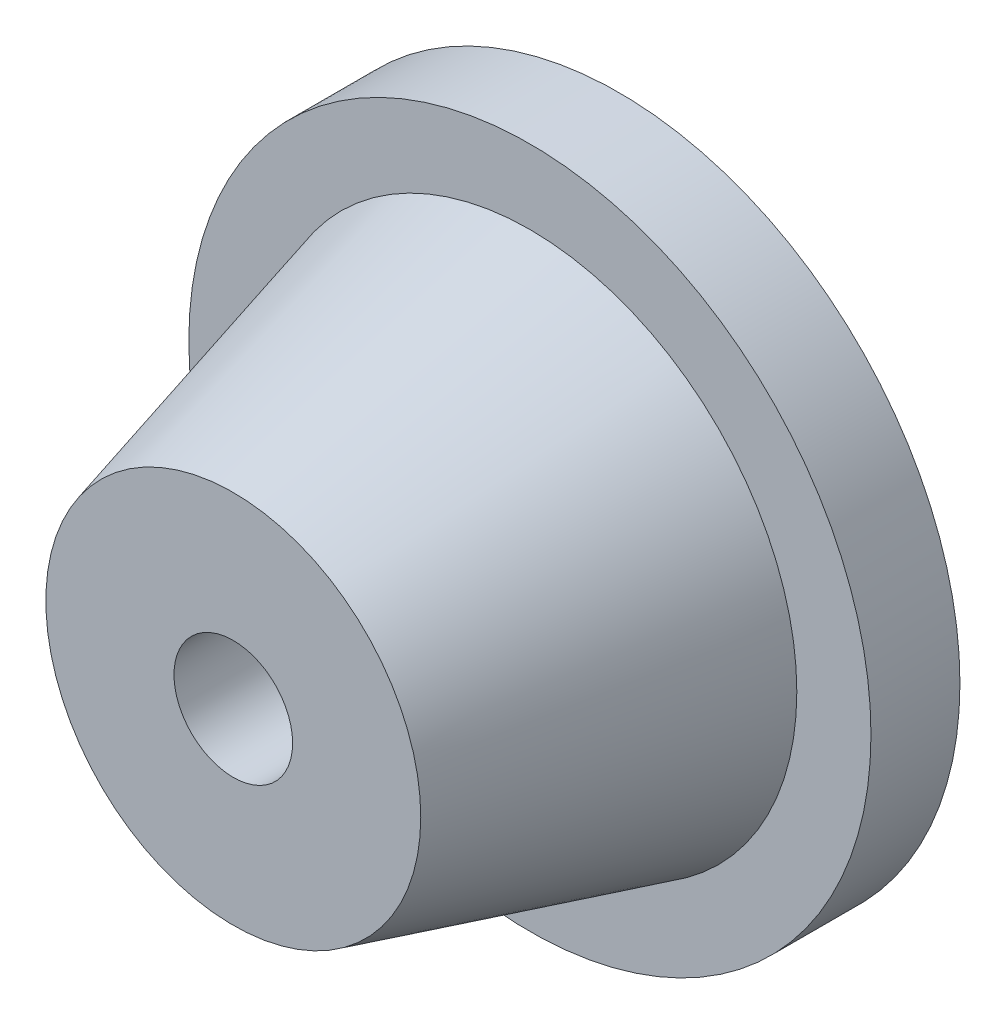
from build123d import *

# Parameters (mm, degrees)
SKETCH1_R           = 11.5
BOSS_EXTRUDE1_DEPTH = 3
SKETCH2_R           = 9
BOSS_EXTRUDE2_DEPTH = 10
BOSS_EXTRUDE2_TAPER = 15
SKETCH3_R           = 2
CUT_EXTRUDE1_DEPTH  = 21.820662814


with BuildPart() as part:
    # Sketch1 → Boss-Extrude1 (new body)
    with BuildSketch(Plane.XY):
        Circle(SKETCH1_R)
    extrude(amount=BOSS_EXTRUDE1_DEPTH)

    # Sketch2 → Boss-Extrude2 (add)
    with BuildSketch(Plane.XY.offset(3)):
        Circle(SKETCH2_R)
    extrude(amount=BOSS_EXTRUDE2_DEPTH, taper=BOSS_EXTRUDE2_TAPER)

    # Sketch3 → Cut-Extrude1 (cut, through all)
    with BuildSketch(Plane.XY.offset(13)):
        Circle(SKETCH3_R)
    extrude(amount=-CUT_EXTRUDE1_DEPTH, mode=Mode.SUBTRACT)


solid = part.part
